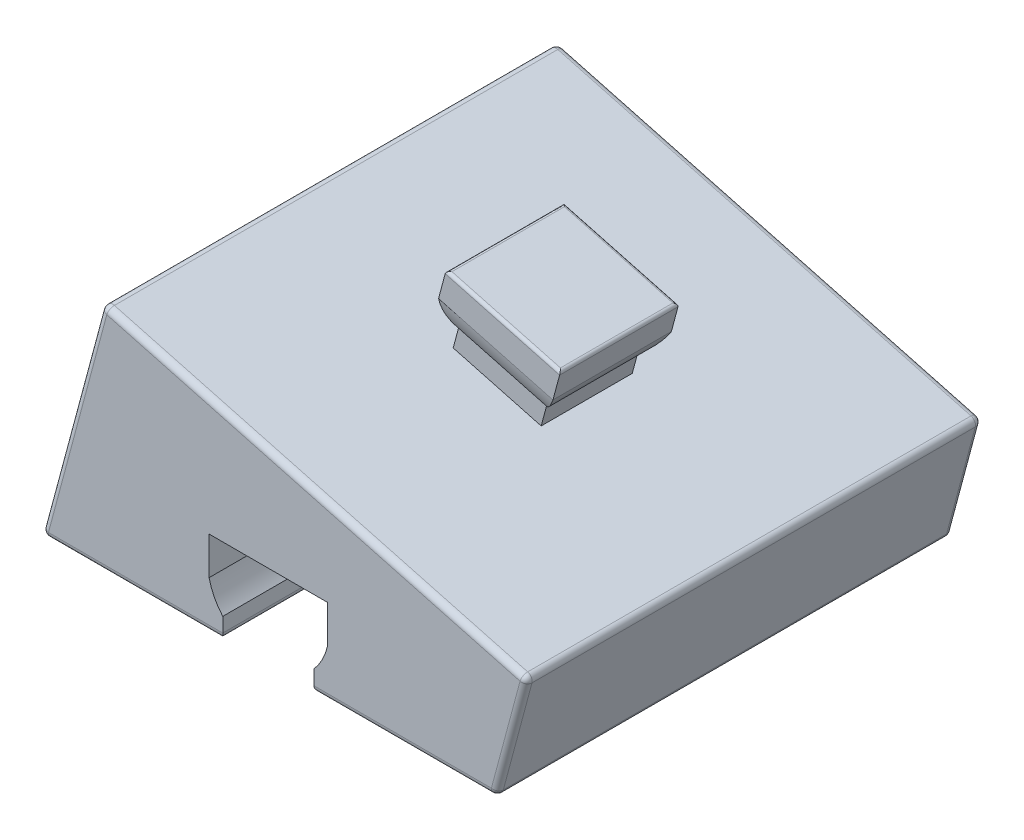
from build123d import *

# Parameters (mm, degrees)
EXTRUDE_1_DEPTH      = 7.5
EXTRUDE_1_DEPTH_BACK = 7.5
EXTRUDE_2_DEPTH      = 1.5
EXTRUDE_2_DEPTH_BACK = 1.5
EXTRUDE_3_DEPTH      = 2
EXTRUDE_3_DEPTH_BACK = 2
CUT_EXTRUDE_1_DEPTH  = 16.207955299
FILLET_1_R           = 0.2
FILLET_2_R           = 0.1


with BuildPart() as part:
    # 草图1 → 凸台-拉伸1 (new, two sides: drawn at the far end of the back side and taken through both)
    with BuildSketch(Plane.XY.offset(-EXTRUDE_1_DEPTH_BACK)):
        with BuildLine():
            Line((-7.5, 0), (-1.5, 0))
            Line((-1.5, 0), (-1.5, 0.677124344))
            ThreePointArc((-1.5, 0.677124344), (-1.780042303, 1.088161527), (-1.95, 1.555590279))
            Line((-1.95, 1.555590279), (-1.95, 2.8))
            Line((-1.95, 2.8), (1.95, 2.8))
            Line((1.95, 2.8), (1.95, 1.555590279))
            ThreePointArc((1.95, 1.555590279), (1.780042303, 1.088161527), (1.5, 0.677124344))
            Line((1.5, 0.677124344), (1.5, 0))
            Line((1.5, 0), (7.5, 0))
            Line((7.5, 0), (8.53527618, 3.863703305))
            Line((8.53527618, 3.863703305), (-5.459914348, 7.613703305))
            Line((-5.459914348, 7.613703305), (-7.5, 0))
        make_face()
    extrude(amount=EXTRUDE_1_DEPTH + EXTRUDE_1_DEPTH_BACK)

    # 草图2 → 凸台-拉伸2 (add, two sides: drawn at the far end of the back side and taken through both)
    with BuildSketch(Plane.XY.offset(-EXTRUDE_2_DEPTH_BACK)):
        Polygon((0.088792177, 6.126931873), (2.986569656, 5.350474738), (3.245388701, 6.316400564), (0.347611222, 7.092857699), align=None)
    extrude(amount=EXTRUDE_2_DEPTH + EXTRUDE_2_DEPTH_BACK)

    # 草图3 → 凸台-拉伸3 (add, two sides: drawn at the far end of the back side and taken through both)
    with BuildSketch(Plane.XY.offset(-EXTRUDE_3_DEPTH_BACK)):
        with BuildLine():
            Line((2.184728529, 8.153517871), (4.06828389, 7.648820733))
            Line((4.06828389, 7.648820733), (3.823852668, 6.736590993))
            ThreePointArc((3.823852668, 6.736590993), (3.538706676, 6.329077778), (3.161822332, 6.004526629))
            Line((3.161822332, 6.004526629), (0.264044853, 6.780983765))
            ThreePointArc((0.264044853, 6.780983765), (0.099929011, 7.250495477), (0.056741946, 7.745985269))
            Line((0.056741946, 7.745985269), (0.301173168, 8.658215009))
            Line((0.301173168, 8.658215009), (2.184728529, 8.153517871))
        make_face()
    extrude(amount=EXTRUDE_3_DEPTH + EXTRUDE_3_DEPTH_BACK)

    # 草图4 → 切除-拉伸1 (cut, through all)
    with BuildSketch(Plane(origin=(-1.883555361, 0.504697138, 0), x_dir=(0, 0, 1), z_dir=(-0.9659258262890692, 0.2588190451025178, 0))):
        with BuildLine():
            Line((1.95, 8.441142838), (2, 8.441142838))
            Line((2, 8.441142838), (2, 6.618267183))
            Line((2, 6.618267183), (1.5, 6.618267183))
            ThreePointArc((1.5, 6.618267183), (1.780042303, 7.029304366), (1.95, 7.496733117))
            Line((1.95, 7.496733117), (1.95, 8.441142838))
        make_face()
        with BuildLine():
            Line((-1.95, 8.441142838), (-1.95, 7.496733117))
            ThreePointArc((-1.95, 7.496733117), (-1.780042303, 7.029304366), (-1.5, 6.618267183))
            Line((-1.5, 6.618267183), (-2, 6.618267183))
            Line((-2, 6.618267183), (-2, 8.441142838))
            Line((-2, 8.441142838), (-1.95, 8.441142838))
        make_face()
    extrude(amount=-CUT_EXTRUDE_1_DEPTH, mode=Mode.SUBTRACT)

    # 圆角1
    fillet_1_edges = [part.edges().sort_by_distance(p)[0] for p in [
        (4.5, 0, -7.5),
        (1.5, 0, 0),
        (4.5, 0, 7.5),
        (-4.5, 0, -7.5),
        (-4.5, 0, 7.5),
        (-1.5, 0, 0),
        (-6.479957174, 3.806851653, -7.5),
        (-5.459914348, 7.613703305, 0),
        (-6.479957174, 3.806851653, 7.5),
        (-7.5, 0, 0),
        (8.01763809, 1.931851653, -7.5),
        (7.5, 0, 0),
        (8.01763809, 1.931851653, 7.5),
        (8.53527618, 3.863703305, 0),
        (1.537680916, 5.738703305, -7.5),
        (1.537680916, 5.738703305, 7.5),
    ]]
    fillet(fillet_1_edges, radius=FILLET_1_R)

    # 圆角2
    fillet_2_edges = [part.edges().sort_by_distance(p)[0] for p in [
        (4.06828389, 7.648820733, 0),
        (2.184728529, 8.153517871, 1.95),
        (0.301173168, 8.658215009, 0),
        (2.184728529, 8.153517871, -1.95),
    ]]
    fillet(fillet_2_edges, radius=FILLET_2_R)


solid = part.part
